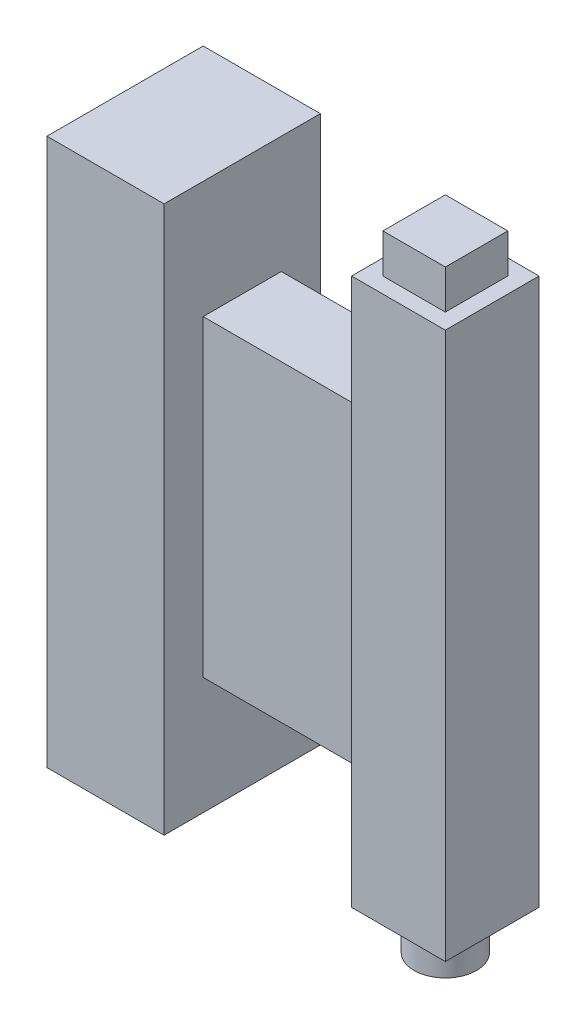
from build123d import *

# Parameters (mm, degrees)
SKETCH1_W           = 15
SKETCH1_H           = 70
BOSS_EXTRUDE1_DEPTH = 10
SKETCH2_W           = 20
SKETCH2_H           = 40
BOSS_EXTRUDE2_DEPTH = 5
SKETCH5_W           = 12
SKETCH5_H           = 70
BOSS_EXTRUDE4_DEPTH = 6
SKETCH6_W           = 8
SKETCH6_H           = 8
BOSS_EXTRUDE5_DEPTH = 5
SKETCH7_R           = 4
BOSS_EXTRUDE6_DEPTH = 5
SKETCH8_R           = 5
CUT_EXTRUDE1_DEPTH  = 5


with BuildPart() as part:
    # Sketch1 → Boss-Extrude1 (new, symmetric)
    with BuildSketch(Plane.XY):
        Rectangle(SKETCH1_W, SKETCH1_H)
    extrude(amount=BOSS_EXTRUDE1_DEPTH, both=True)

    # Sketch2 → Boss-Extrude2 (add, symmetric)
    with BuildSketch(Plane.XY):
        with Locations((17.5, 0)):
            Rectangle(SKETCH2_W, SKETCH2_H)
    extrude(amount=BOSS_EXTRUDE2_DEPTH, both=True)

    # Sketch5 → Boss-Extrude4 (add, symmetric)
    with BuildSketch(Plane.XY):
        with Locations((33.5, 0)):
            Rectangle(SKETCH5_W, SKETCH5_H)
    extrude(amount=BOSS_EXTRUDE4_DEPTH, both=True)

    # Sketch6 → Boss-Extrude5 (add)
    with BuildSketch(Plane(origin=(0, 35, 0), x_dir=(1, 0, 0), z_dir=(0, 1, 0))):
        with Locations((33.5, 0)):
            Rectangle(SKETCH6_W, SKETCH6_H)
    extrude(amount=BOSS_EXTRUDE5_DEPTH)

    # Sketch7 → Boss-Extrude6 (add)
    with BuildSketch(Plane.XZ.offset(35)):
        with Locations(Location((33.5, 0, 0), (0, 0, 270))):
            Circle(SKETCH7_R)
    extrude(amount=BOSS_EXTRUDE6_DEPTH)

    # Sketch8 → Cut-Extrude1 (cut)
    with BuildSketch(Plane.ZY.offset(7.5)):
        with Locations(Location((0, 27, 0), (0, 0, 270))):
            Circle(SKETCH8_R)
        with Locations(Location((0, 9, 0), (0, 0, 270))):
            Circle(SKETCH8_R)
        with Locations(Location((0, -9, 0), (0, 0, 270))):
            Circle(SKETCH8_R)
        with Locations(Location((0, -27, 0), (0, 0, 270))):
            Circle(SKETCH8_R)
    extrude(amount=-CUT_EXTRUDE1_DEPTH, mode=Mode.SUBTRACT)


solid = part.part
